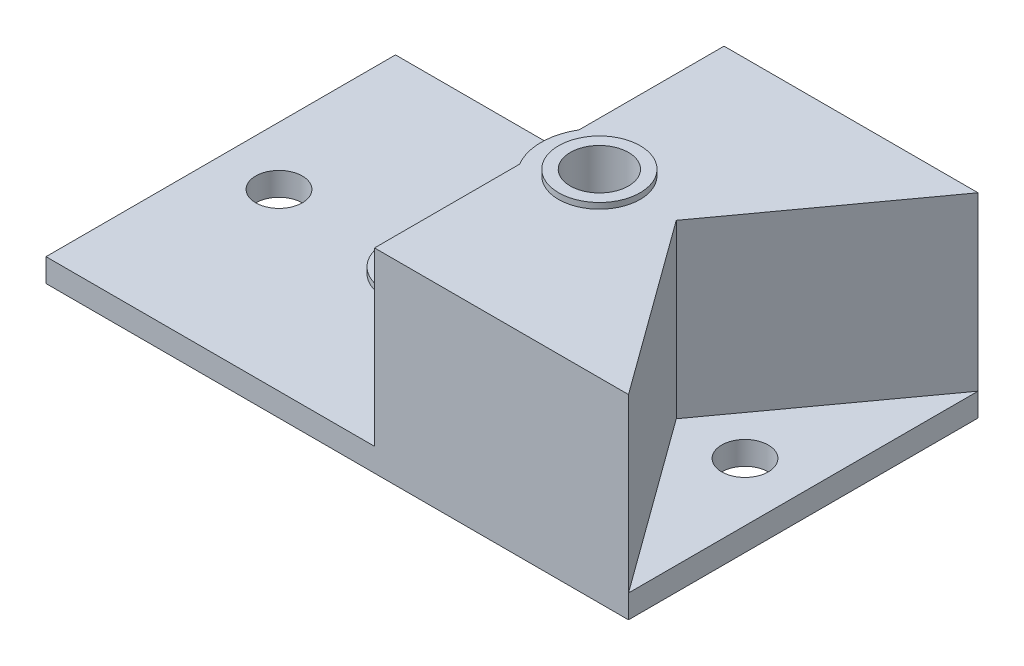
from build123d import *

# Parameters (mm, degrees)
SKETCH1_W           = 50
SKETCH1_H           = 30
SKETCH1_R           = 2
SKETCH1_R_2         = 2.5
BOSS_EXTRUDE1_DEPTH = 2
SKETCH2_R           = 5
SKETCH2_R_2         = 2.5
BOSS_EXTRUDE2_DEPTH = 14.75
SKETCH3_R           = 3.5
SKETCH3_R_2         = 2.5
BOSS_EXTRUDE3_DEPTH = 0.5
SKETCH4_R           = 3.5
SKETCH4_R_2         = 2.5
BOSS_EXTRUDE4_DEPTH = 0.5
BOSS_EXTRUDE5_DEPTH = 14.75


with BuildPart() as part:
    # Sketch1 → Boss-Extrude1 (new body)
    with BuildSketch(Plane(origin=(0, 0, 0), x_dir=(1, 0, 0), z_dir=(0, 1, 0))):
        with Locations((25, 15)):
            Rectangle(SKETCH1_W, SKETCH1_H)
        with Locations(Location((5, 15, 0), (0, 0, 270))):
            Circle(SKETCH1_R, mode=Mode.SUBTRACT)
        with Locations(Location((45, 15, 0), (0, 0, 270))):
            Circle(SKETCH1_R, mode=Mode.SUBTRACT)
        with Locations(Location((17.5, 15, 0), (0, 0, 270))):
            Circle(SKETCH1_R_2, mode=Mode.SUBTRACT)
        with Locations(Location((32.5, 15, 0), (0, 0, 270))):
            Circle(SKETCH1_R_2, mode=Mode.SUBTRACT)
    extrude(amount=BOSS_EXTRUDE1_DEPTH)

    # Sketch2 → Boss-Extrude2 (add)
    with BuildSketch(Plane(origin=(0, 2, 0), x_dir=(1, 0, 0), z_dir=(0, 1, 0))):
        with Locations(Location((32.5, 15, 0), (0, 0, 90))):
            Circle(SKETCH2_R)
        with Locations(Location((32.5, 15, 0), (0, 0, 270))):
            Circle(SKETCH2_R_2, mode=Mode.SUBTRACT)
    extrude(amount=BOSS_EXTRUDE2_DEPTH)

    # Sketch3 → Boss-Extrude3 (add)
    with BuildSketch(Plane(origin=(0, 2, 0), x_dir=(1, 0, 0), z_dir=(0, 1, 0))):
        with Locations(Location((17.5, 15, 0), (0, 0, 90))):
            Circle(SKETCH3_R)
        with Locations(Location((17.5, 15, 0), (0, 0, 270))):
            Circle(SKETCH3_R_2, mode=Mode.SUBTRACT)
    extrude(amount=BOSS_EXTRUDE3_DEPTH)

    # Sketch4 → Boss-Extrude4 (add)
    with BuildSketch(Plane(origin=(0, 16.75, 0), x_dir=(1, 0, 0), z_dir=(0, 1, 0))):
        with Locations(Location((32.5, 15, 0), (0, 0, 270))):
            Circle(SKETCH4_R)
        with Locations(Location((32.5, 15, 0), (0, 0, 270))):
            Circle(SKETCH4_R_2, mode=Mode.SUBTRACT)
    extrude(amount=BOSS_EXTRUDE4_DEPTH)

    # Sketch5 → Boss-Extrude5 (add)
    with BuildSketch(Plane(origin=(0, 2, 0), x_dir=(1, 0, 0), z_dir=(0, 1, 0))):
        with BuildLine():
            Line((50, 30), (28.200775839, 30))
            Line((28.200775839, 30), (28.200775839, 17.552777235))
            ThreePointArc((28.200775839, 17.552777235), (33.823608551, 19.821624249), (37.5, 15))
            ThreePointArc((37.5, 15), (33.823608551, 10.178375751), (28.200775839, 12.447222765))
            Line((28.200775839, 12.447222765), (28.200775839, 0))
            Line((28.200775839, 0), (50, 0))
            Line((50, 0), (39.100387919, 15))
            Line((39.100387919, 15), (50, 30))
        make_face()
    extrude(amount=BOSS_EXTRUDE5_DEPTH)


solid = part.part
